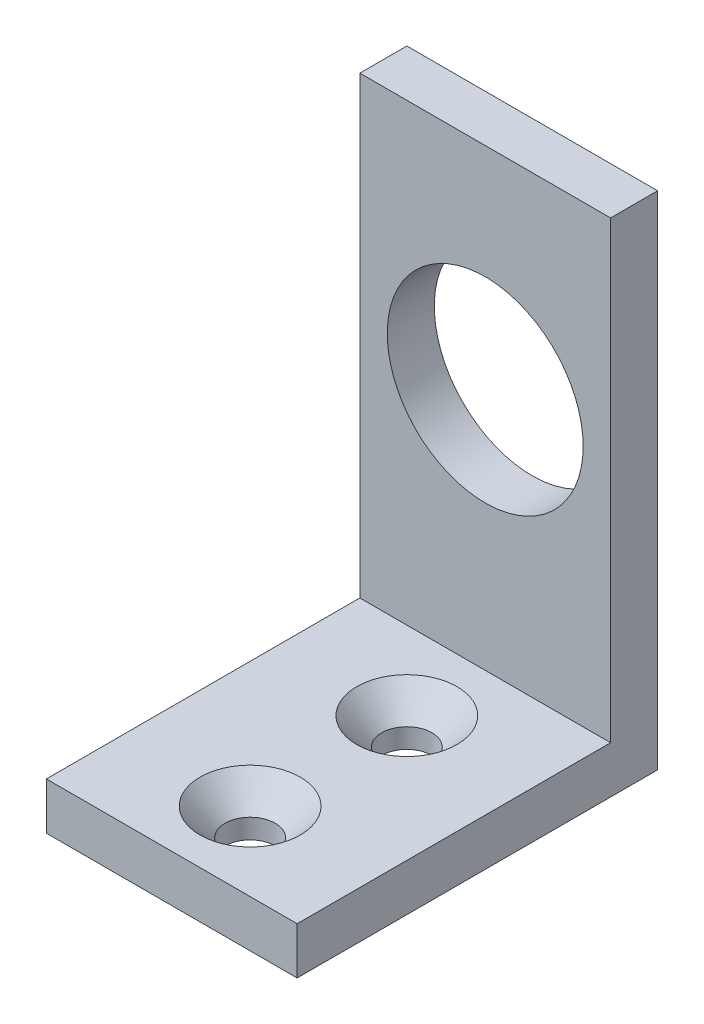
from build123d import *

# Parameters (mm, degrees)
SKETCH1_W           = 23
SKETCH1_H           = 3
SKETCH1_W_2         = 3
SKETCH1_H_2         = 29
BOSS_EXTRUDE1_DEPTH = 16
HOLE1_AT_2_COUNT    = 2
HOLE1_AT_2_PITCH    = 10
SKETCH5_R           = 6.25
CUT_EXTRUDE1_DEPTH  = 39.691084244


with BuildPart() as part:
    # Sketch1 → Boss-Extrude1 (new body)
    with BuildSketch(Plane(origin=(0, 0, 0), x_dir=(0, 0, -1), z_dir=(1, 0, 0))):
        with Locations((11.5, -1.5)):
            Rectangle(SKETCH1_W, SKETCH1_H)
        with Locations((21.5, 14.5)):
            Rectangle(SKETCH1_W_2, SKETCH1_H_2)
    extrude(amount=BOSS_EXTRUDE1_DEPTH)

    # Sketch4 → Hole1 (revolve, cut)
    with BuildSketch(Plane(origin=(8, 0, -5), x_dir=(0, 0, 1), z_dir=(1, 0, 0))):
        Polygon((0, 0), (0, 3), (1.6, 3), (1.6, 1.746093602), (3.2, 0), align=None)
    hole1 = revolve(axis=Axis((8, 6.445314094, -5), (0, -1, 0)), mode=Mode.SUBTRACT)

    # Hole1 at 2: Hole1 ×2
    with Locations(*[(0, 0, -i * HOLE1_AT_2_PITCH) for i in range(1, HOLE1_AT_2_COUNT)]):
        add(hole1, mode=Mode.SUBTRACT)

    # Sketch5 → Cut-Extrude1 (cut, through all)
    with BuildSketch(Plane.XY.offset(-20)):
        with Locations((8, 15.5)):
            Circle(SKETCH5_R)
    extrude(amount=-CUT_EXTRUDE1_DEPTH, mode=Mode.SUBTRACT)


solid = part.part
